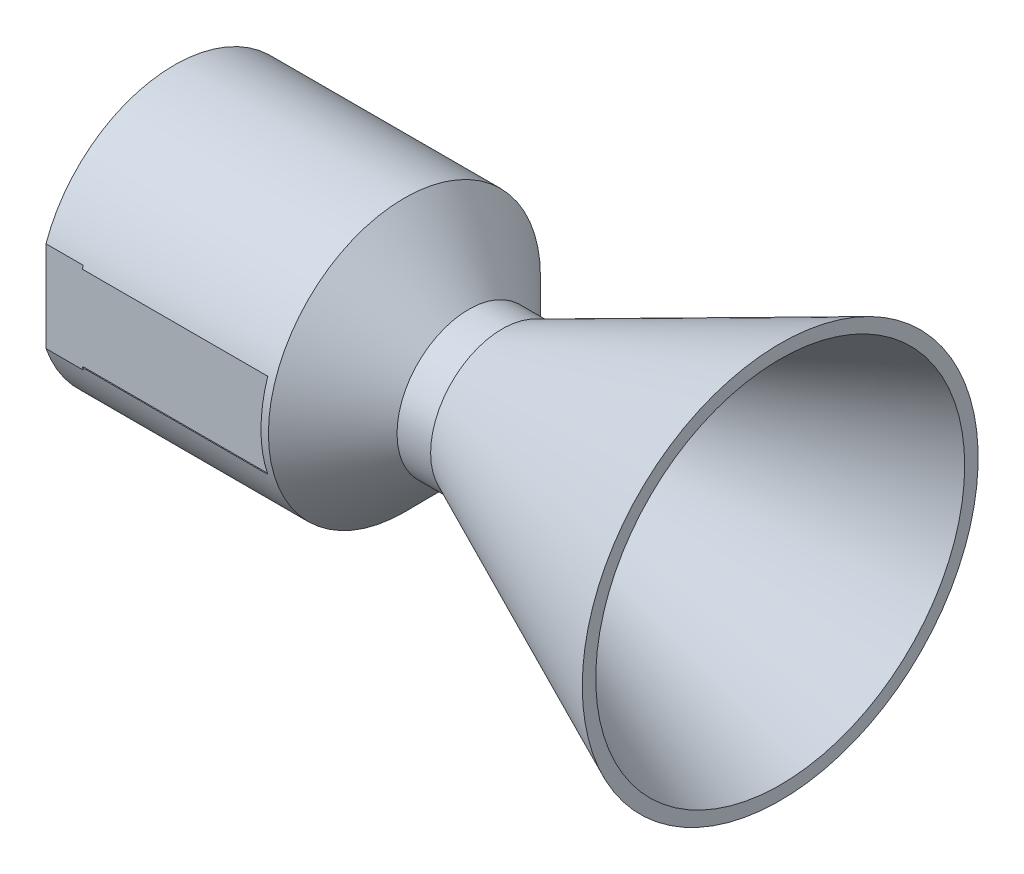
from build123d import *

# Parameters (mm, degrees)
SCALE1_SCALE        = 3
SKETCH5_W           = 6.092075514
SKETCH5_H           = 37.994626104
SKETCH5_W_2         = 6.963088047
CUT_EXTRUDE1_DEPTH  = 213.004502745
SCALE2_SCALE        = 0.6
BOSS_EXTRUDE1_DEPTH = 10


with BuildPart() as part:
    # Sketch1 → Revolve1 (revolve)
    with BuildSketch(Plane.XY, mode=Mode.PRIVATE) as revolve1_sk:
        Polygon((84.678634707, 29.475453574), (84.678634707, 27.468448008), (43.302663782, 8.644223267), (37.73625143, 8.644223267), (28.722559742, 17.657914956), (0, 17.657914956), (0, 20.25452291), (28.722559742, 20.25452291), (38.298141584, 10.678941067), (43.302663782, 10.678941067), align=None)
    revolve(revolve1_sk.sketch.rotate(Axis((0, 0, 0), (1, 0, 0)), 90), axis=Axis((0, 0, 0), (1, 0, 0)))


with BuildPart() as part_1:
    # Scale1: scaled about (41.420833763, 0, 0)
    add(part.part.scale(SCALE1_SCALE).moved(Location((-82.841667526, 0, 0))))

    # Sketch5 → Cut-Extrude1 (cut, through all)
    with BuildSketch(Plane(origin=(0, 0, 0), x_dir=(0, 0, -1), z_dir=(1, 0, 0))):
        with Locations((60.76356873, 0)):
            Rectangle(SKETCH5_W, SKETCH5_H)
        with Locations((-60.763568731, 0)):
            Rectangle(SKETCH5_W_2, SKETCH5_H)
    extrude(amount=-CUT_EXTRUDE1_DEPTH, mode=Mode.SUBTRACT)


with BuildPart() as part_2:
    # Scale2: scaled about (43.48021303, 0, -0.13779422)
    add(part_1.part.scale(SCALE2_SCALE).moved(Location((17.392085212, 0, -0.055117688))))

    # Sketch6 → Boss-Extrude1 (add)
    with BuildSketch(Plane.ZY.offset(32.312915304)):
        with BuildLine():
            Line((-34.685636272, 11.398387831), (-34.685636272, -11.398387831))
            ThreePointArc((-34.685636272, -11.398387831), (-0.459415669, -36.455899464), (34.314097136, -12.163598765))
            Line((34.314097136, -12.163598765), (34.314097136, -11.398387831))
            Line((34.314097136, -11.398387831), (34.314097136, 11.398387831))
            Line((34.314097136, 11.398387831), (34.314097136, 12.163598765))
            ThreePointArc((34.314097136, 12.163598765), (-0.459415669, 36.455899464), (-34.685636272, 11.398387831))
        make_face()
    extrude(amount=BOSS_EXTRUDE1_DEPTH)


solid = part_2.part
